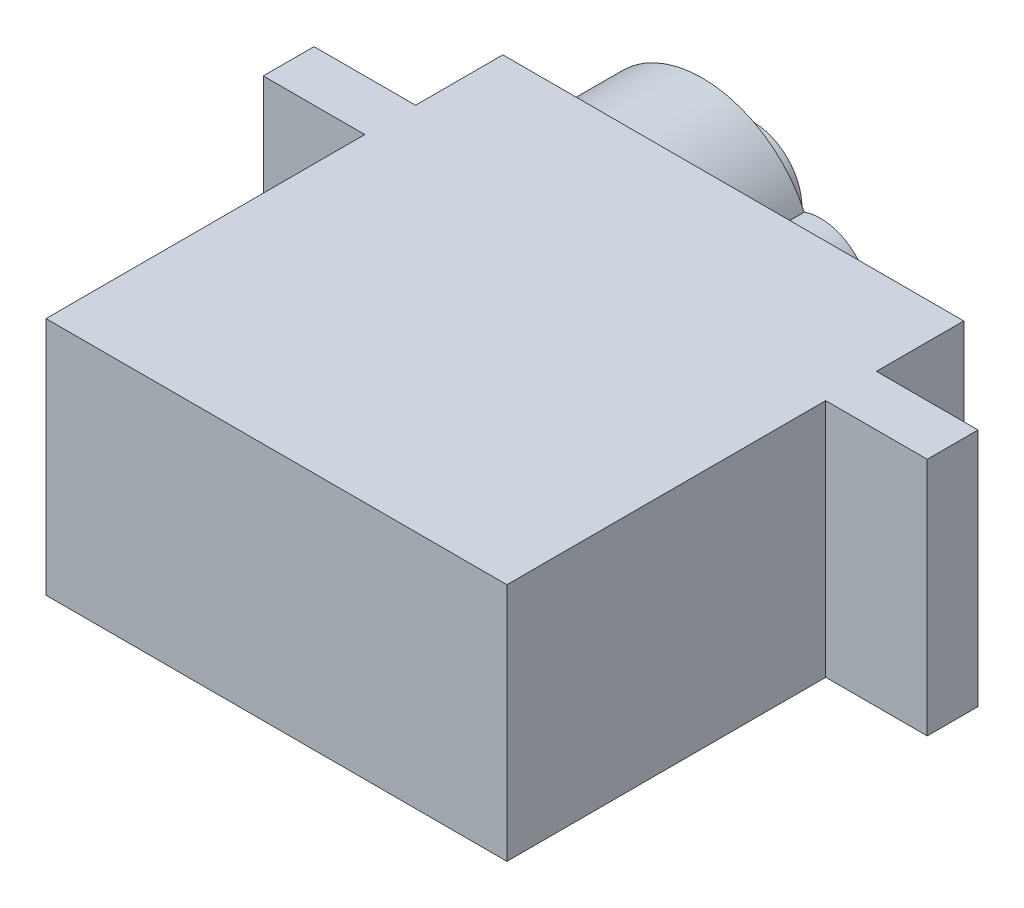
from build123d import *

# Parameters (mm, degrees)
SALIENTE_EXTRUIR1_DEPTH = 11.8
CROQUIS7_R              = 5.525
CROQUIS7_R_2            = 2.45
SALIENTE_EXTRUIR2_DEPTH = 4.3
SALIENTE_EXTRUIR4_DEPTH = 2.5


with BuildPart() as part:
    # Croquis3 → Saliente-Extruir1 (new body)
    with BuildSketch(Plane(origin=(0, 0, 0), x_dir=(1, 0, 0), z_dir=(0, 1, 0))):
        Polygon((-11.35, 11.25), (11.35, 11.25), (11.35, 6.95), (16.35, 6.95), (16.35, 4.45), (11.35, 4.45), (11.35, -11.25), (-11.35, -11.25), (-11.35, 4.45), (-16.35, 4.45), (-16.35, 6.95), (-11.35, 6.95), align=None)
    extrude(amount=SALIENTE_EXTRUIR1_DEPTH)

    # Croquis7 → Saliente-Extruir2 (add)
    with BuildSketch(Plane(origin=(0, 0, -11.25), x_dir=(-1, 0, 0), z_dir=(0, 0, -1))):
        with Locations((5.825, 5.9)):
            Circle(CROQUIS7_R)
        with Locations((0, 5.9)):
            Circle(CROQUIS7_R_2)
    extrude(amount=SALIENTE_EXTRUIR2_DEPTH)

    # Croquis8 → Saliente-Extruir4 (add)
    with BuildSketch(Plane(origin=(0, 0, -15.55), x_dir=(-1, 0, 0), z_dir=(0, 0, -1))):
        with BuildLine():
            ThreePointArc((8.225, 5.9), (7.522056275, 7.597056275), (5.825, 8.3))
            Line((5.825, 8.3), (5.825, 6.475))
            ThreePointArc((5.825, 6.475), (6.231586399, 6.306586399), (6.4, 5.9))
            ThreePointArc((6.4, 5.9), (6.231586399, 5.493413601), (5.825, 5.325))
            Line((5.825, 5.325), (5.825, 3.5))
            ThreePointArc((5.825, 3.5), (7.522056275, 4.202943725), (8.225, 5.9))
        make_face()
        with BuildLine():
            Line((5.825, 6.475), (5.825, 8.3))
            ThreePointArc((5.825, 8.3), (3.425, 5.9), (5.825, 3.5))
            Line((5.825, 3.5), (5.825, 5.325))
            ThreePointArc((5.825, 5.325), (5.25, 5.9), (5.825, 6.475))
        make_face()
    extrude(amount=SALIENTE_EXTRUIR4_DEPTH)


solid = part.part
